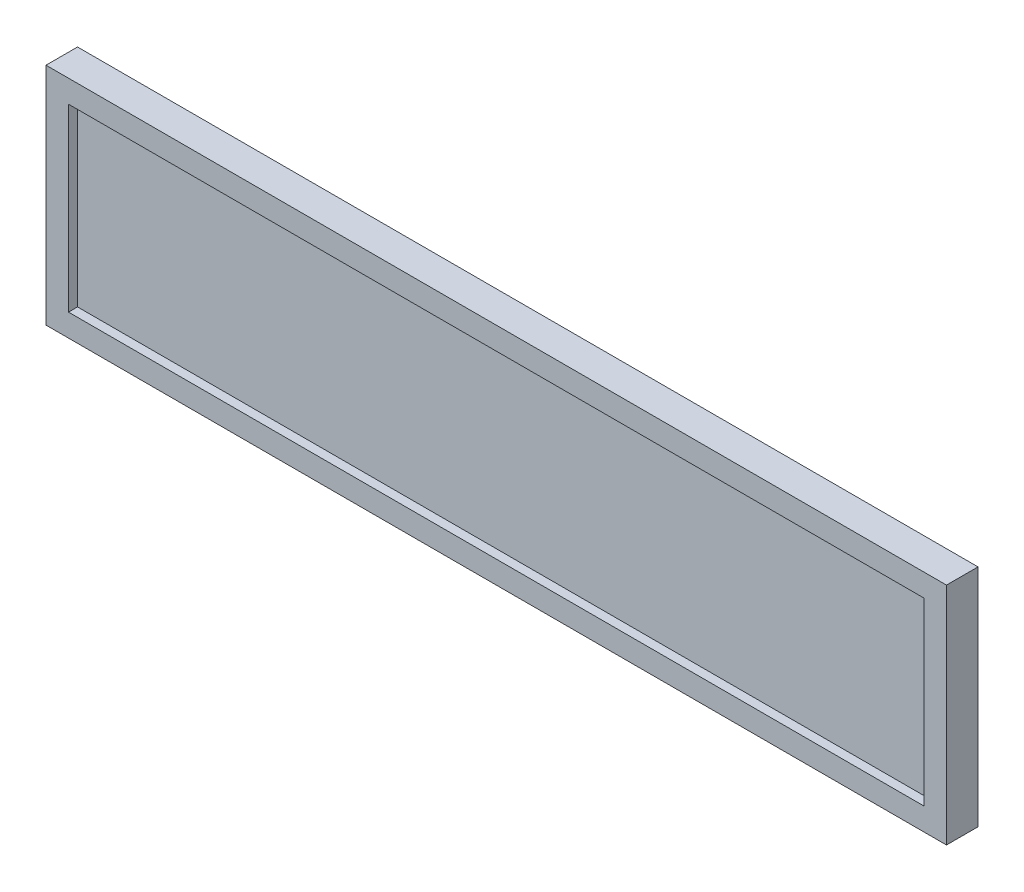
from build123d import *

# Parameters (mm, degrees)
ESQUISSE1_W        = 10000
ESQUISSE1_H        = 2500
BOSS_EXTRU_1_DEPTH = 250
ESQUISSE2_W        = 10000
ESQUISSE2_H        = 2500
ESQUISSE2_W_2      = 9500
ESQUISSE2_H_2      = 2000
BOSS_EXTRU_2_DEPTH = 100


with BuildPart() as part:
    # Esquisse1 → Boss.-Extru.1 (new body)
    with BuildSketch(Plane.XY):
        Rectangle(ESQUISSE1_W, ESQUISSE1_H)
    extrude(amount=BOSS_EXTRU_1_DEPTH)

    # Esquisse2 → Boss.-Extru.2 (add)
    with BuildSketch(Plane.XY.offset(250)):
        Rectangle(ESQUISSE2_W, ESQUISSE2_H)
        Rectangle(ESQUISSE2_W_2, ESQUISSE2_H_2, mode=Mode.SUBTRACT)
    extrude(amount=BOSS_EXTRU_2_DEPTH)


solid = part.part
